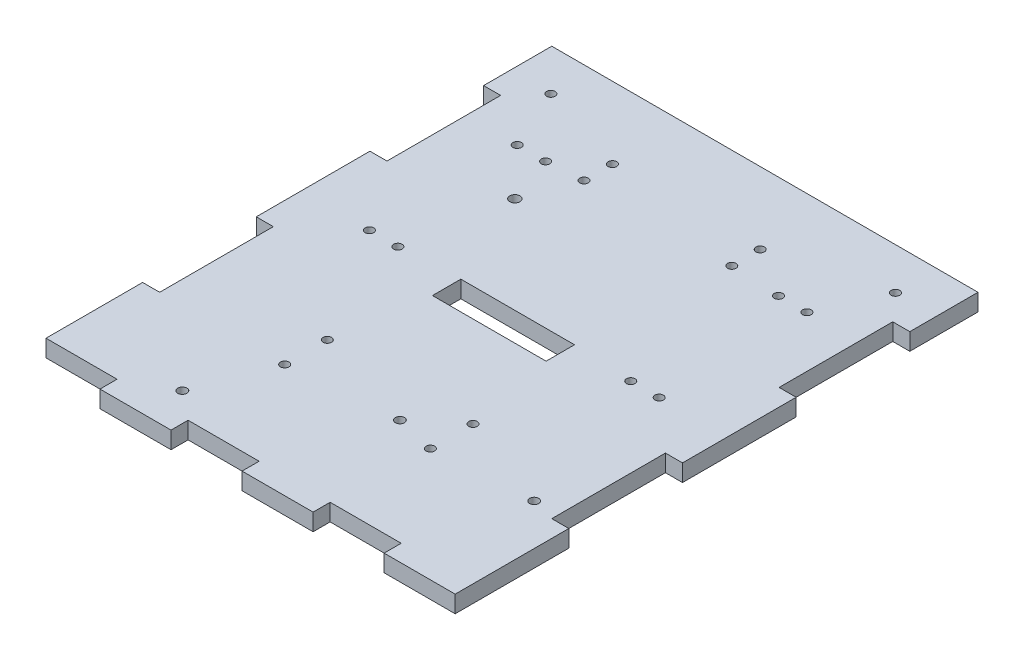
from build123d import *

# Parameters (mm, degrees)
SKETCH1_W                = 150
SKETCH1_H                = 184
BOSS_EXTRUDE1_DEPTH      = 6
SKETCH2_W                = 6
SKETCH2_H                = 40
CUT_EXTRUDE1_DEPTH       = 6
SKETCH11_W               = 25
SKETCH11_H               = 6
CUT_EXTRUDE10_DEPTH      = 6
CUT_EXTRUDE11_REACH      = 120.849
SKETCH12_R               = 1.6
CUT_EXTRUDE12_REACH      = 120.849
SKETCH13_R               = 1.8
CUT_EXTRUDE13_REACH      = 120.849
SKETCH14_R               = 1.6
CUT_EXTRUDE14_REACH      = 120.849
SKETCH15_W               = 40
SKETCH15_H               = 10
SKETCH16_R               = 1.5
CUT_EXTRUDE15_DEPTH      = 6
SKETCH17_R               = 1.5
CUT_EXTRUDE16_DEPTH      = 6
CUT_EXTRUDE17_DEPTH      = 119.966381806
CUT_EXTRUDE17_DEPTH_BACK = 7.5
SKETCH18_R               = 1.5


with BuildPart() as part:
    # Sketch1 → Boss-Extrude1 (new body)
    with BuildSketch(Plane(origin=(0, 0, 0), x_dir=(1, 0, 0), z_dir=(0, 1, 0))):
        Rectangle(SKETCH1_W, SKETCH1_H)
    extrude(amount=BOSS_EXTRUDE1_DEPTH)

    # Sketch2 → Cut-Extrude1 (cut)
    with BuildSketch(Plane(origin=(0, 6, 0), x_dir=(1, 0, 0), z_dir=(0, 1, 0))):
        with Locations((-72, 48)):
            Rectangle(SKETCH2_W, SKETCH2_H)
        with Locations((72, 48)):
            Rectangle(SKETCH2_W, SKETCH2_H)
        with Locations((72, -32)):
            Rectangle(SKETCH2_W, SKETCH2_H)
        with Locations((-72, -32)):
            Rectangle(SKETCH2_W, SKETCH2_H)
    extrude(amount=-CUT_EXTRUDE1_DEPTH, mode=Mode.SUBTRACT)

    # Sketch11 → Cut-Extrude10 (cut)
    with BuildSketch(Plane(origin=(0, 6, 0), x_dir=(1, 0, 0), z_dir=(0, 1, 0))):
        with Locations((-12.5, -89)):
            Rectangle(SKETCH11_W, SKETCH11_H)
        with Locations((-62.5, -89)):
            Rectangle(SKETCH11_W, SKETCH11_H)
        with Locations((37.5, -89)):
            Rectangle(SKETCH11_W, SKETCH11_H)
    extrude(amount=-CUT_EXTRUDE10_DEPTH, mode=Mode.SUBTRACT)

    # Sketch12 → Cut-Extrude11 (cut, up to next)
    with BuildSketch(Plane(origin=(0, 6, 0), x_dir=(1, 0, 0), z_dir=(0, 1, 0)), mode=Mode.PRIVATE) as cut_extrude11_sk1:
        with Locations(Location((-35, -78, 0), (0, 0, 270))):
            Circle(SKETCH12_R)
    cut_extrude11_tool1 = extrude(cut_extrude11_sk1.sketch, amount=-CUT_EXTRUDE11_REACH, mode=Mode.PRIVATE) & part.part
    add(cut_extrude11_tool1.solids().sort_by_distance((-35, 6, 78))[0], mode=Mode.SUBTRACT)

    # Sketch13 → Cut-Extrude12 (cut, up to next)
    with BuildSketch(Plane(origin=(0, 6, 0), x_dir=(1, 0, 0), z_dir=(0, 1, 0)), mode=Mode.PRIVATE) as cut_extrude12_sk1:
        with Locations(Location((-35, 39, 0), (0, 0, 270))):
            Circle(SKETCH13_R)
    cut_extrude12_tool1 = extrude(cut_extrude12_sk1.sketch, amount=-CUT_EXTRUDE12_REACH, mode=Mode.PRIVATE) & part.part
    add(cut_extrude12_tool1.solids().sort_by_distance((-35, 6, -39))[0], mode=Mode.SUBTRACT)

    # Sketch14 → Cut-Extrude13 (cut, up to next)
    with BuildSketch(Plane(origin=(0, 6, 0), x_dir=(1, 0, 0), z_dir=(0, 1, 0)), mode=Mode.PRIVATE) as cut_extrude13_sk1:
        with Locations(Location((12.25, -48.7, 0), (0, 0, 270))):
            Circle(SKETCH14_R)
    cut_extrude13_tool1 = extrude(cut_extrude13_sk1.sketch, amount=-CUT_EXTRUDE13_REACH, mode=Mode.PRIVATE) & part.part
    # Sketch14 → Cut-Extrude13 (cut, up to next)
    with BuildSketch(Plane(origin=(0, 6, 0), x_dir=(1, 0, 0), z_dir=(0, 1, 0)), mode=Mode.PRIVATE) as cut_extrude13_sk2:
        with Locations(Location((60.5, -49.7, 0), (0, 0, 270))):
            Circle(SKETCH14_R)
    cut_extrude13_tool2 = extrude(cut_extrude13_sk2.sketch, amount=-CUT_EXTRUDE13_REACH, mode=Mode.PRIVATE) & part.part
    add(cut_extrude13_tool1.solids().sort_by_distance((12.25, 6, 48.7))[0], mode=Mode.SUBTRACT)
    add(cut_extrude13_tool2.solids().sort_by_distance((60.5, 6, 49.7))[0], mode=Mode.SUBTRACT)

    # Sketch15 → Cut-Extrude14 (cut, up to next)
    with BuildSketch(Plane(origin=(0, 6, 0), x_dir=(1, 0, 0), z_dir=(0, 1, 0)), mode=Mode.PRIVATE) as cut_extrude14_sk1:
        Rectangle(SKETCH15_W, SKETCH15_H)
    cut_extrude14_tool1 = extrude(cut_extrude14_sk1.sketch, amount=-CUT_EXTRUDE14_REACH, mode=Mode.PRIVATE) & part.part
    add(cut_extrude14_tool1.solids().sort_by_distance((0, 6, 0))[0], mode=Mode.SUBTRACT)

    # Sketch16 → Cut-Extrude15 (cut)
    with BuildSketch(Plane.XZ):
        with Locations(Location((60.647463996, -77.306917024, 0), (0, 0, 270))):
            Circle(SKETCH16_R)
        with Locations(Location((50.984493528, -55.803329236, 0), (0, 0, 270))):
            Circle(SKETCH16_R)
        with Locations(Location((40.984493528, -55.803329236, 0), (0, 0, 270))):
            Circle(SKETCH16_R)
        with Locations(Location((50.984493528, -3.803329236, 0), (0, 0, 270))):
            Circle(SKETCH16_R)
        with Locations(Location((40.984493528, -3.803329236, 0), (0, 0, 270))):
            Circle(SKETCH16_R)
        with Locations(Location((26.276108361, 37, 0), (0, 0, 270))):
            Circle(SKETCH16_R)
        with Locations(Location((26.276108361, 52, 0), (0, 0, 270))):
            Circle(SKETCH16_R)
        with Locations(Location((-25, 52, 0), (0, 0, 270))):
            Circle(SKETCH16_R)
        with Locations(Location((-25, 37, 0), (0, 0, 270))):
            Circle(SKETCH16_R)
        with Locations(Location((-40.984493528, -3.803329236, 0), (0, 0, 270))):
            Circle(SKETCH16_R)
        with Locations(Location((-50.984493528, -3.803329236, 0), (0, 0, 270))):
            Circle(SKETCH16_R)
        with Locations(Location((-40.984493528, -55.803329236, 0), (0, 0, 270))):
            Circle(SKETCH16_R)
        with Locations(Location((-50.984493528, -55.803329236, 0), (0, 0, 270))):
            Circle(SKETCH16_R)
        with Locations(Location((-60.647463996, -77.306917024, 0), (0, 0, 270))):
            Circle(SKETCH16_R)
    extrude(amount=-CUT_EXTRUDE15_DEPTH, mode=Mode.SUBTRACT)

    # Sketch17 → Cut-Extrude16 (cut)
    with BuildSketch(Plane(origin=(0, 6, 0), x_dir=(1, 0, 0), z_dir=(0, 1, 0))):
        with Locations(Location((-28.38838906, 66.73080713, 0), (0, 0, 270))):
            Circle(SKETCH17_R)
        with Locations(Location((-28.38838906, 56.73080713, 0), (0, 0, 270))):
            Circle(SKETCH17_R)
        with Locations(Location((23.61161094, 56.73080713, 0), (0, 0, 270))):
            Circle(SKETCH17_R)
        with Locations(Location((23.61161094, 66.73080713, 0), (0, 0, 270))):
            Circle(SKETCH17_R)
    extrude(amount=-CUT_EXTRUDE16_DEPTH, mode=Mode.SUBTRACT)

    # Sketch18 → Cut-Extrude17 (cut, two sides: drawn at the far end of the back side and taken through both)
    with BuildSketch(Plane(origin=(0, -2, 0), x_dir=(-1, 0, 0), z_dir=(0, -1, 0)).offset(-CUT_EXTRUDE17_DEPTH_BACK)):
        with Locations(Location((11.5, 34.184592899, 0), (0, 0, 90))):
            Circle(SKETCH18_R)
        with Locations(Location((-11.5, 34.184592899, 0), (0, 0, 90))):
            Circle(SKETCH18_R)
    extrude(amount=CUT_EXTRUDE17_DEPTH + CUT_EXTRUDE17_DEPTH_BACK, mode=Mode.SUBTRACT)


solid = part.part
